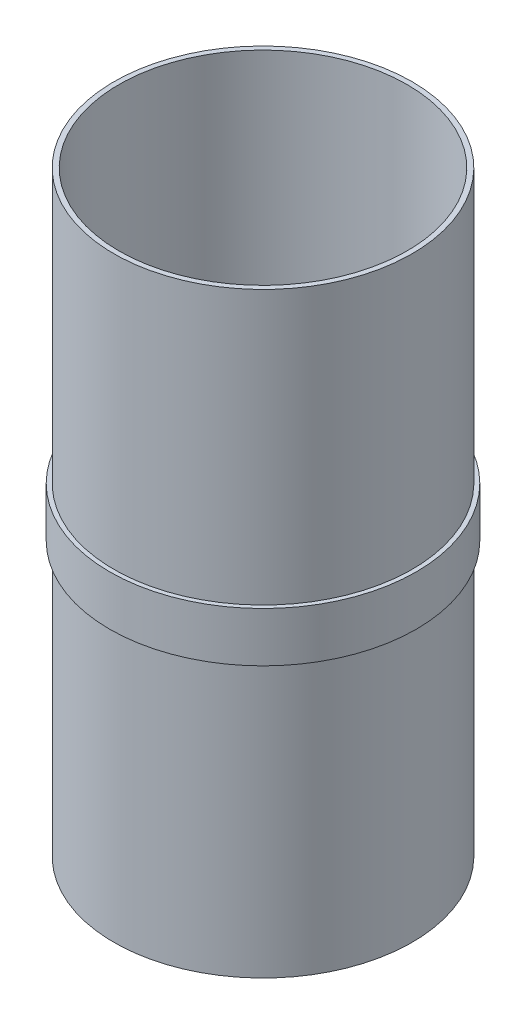
from build123d import *

# Parameters (mm, degrees)
SKETCH1_R           = 78.359
SKETCH1_R_2         = 76.2
BOSS_EXTRUDE1_DEPTH = 12.7
SKETCH2_R           = 76.2
SKETCH2_R_2         = 73.66
BOSS_EXTRUDE2_DEPTH = 152.4


with BuildPart() as part:
    # Sketch1 → Boss-Extrude1 (new, symmetric)
    with BuildSketch(Plane(origin=(0, 0, 0), x_dir=(1, 0, 0), z_dir=(0, 1, 0))):
        with Locations(Location((0, 0, 0), (0, 0, 270))):
            Circle(SKETCH1_R)
        with Locations(Location((0, 0, 0), (0, 0, 270))):
            Circle(SKETCH1_R_2, mode=Mode.SUBTRACT)
    extrude(amount=BOSS_EXTRUDE1_DEPTH, both=True)

    # Sketch2 → Boss-Extrude2 (add, symmetric)
    with BuildSketch(Plane(origin=(0, 0, 0), x_dir=(1, 0, 0), z_dir=(0, 1, 0))):
        with Locations(Location((0, 0, 0), (0, 0, 90))):
            Circle(SKETCH2_R)
        with Locations(Location((0, 0, 0), (0, 0, 90))):
            Circle(SKETCH2_R_2, mode=Mode.SUBTRACT)
    extrude(amount=BOSS_EXTRUDE2_DEPTH, both=True)


solid = part.part
